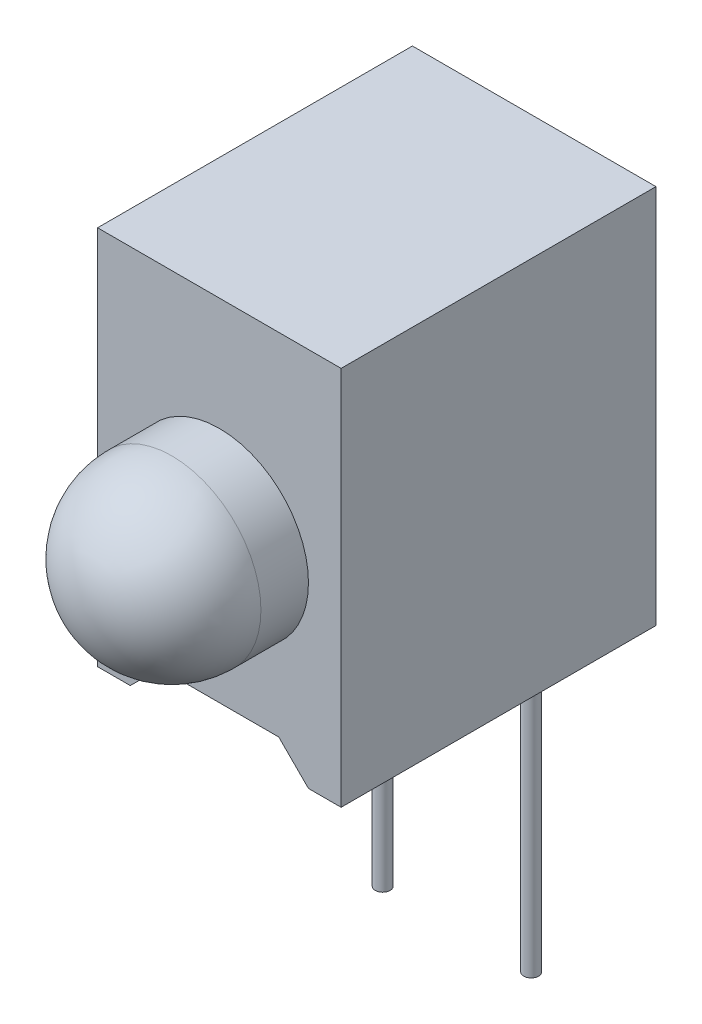
from build123d import *

# Parameters (mm, degrees)
EXTRUDE1_DEPTH = 5.3
SKETCH2_R      = 1.5
EXTRUDE2_DEPTH = 2.3
FILLET1_R      = 1.5
SKETCH3_R      = 0.125
EXTRUDE3_DEPTH = 5.3


with BuildPart() as part:
    # Sketch1 → Extrude1 (new body)
    with BuildSketch(Plane.XY):
        Polygon((-1, 0.5), (1, 0.5), (1.5, 0), (2.05, 0), (2.05, 6.4), (-2.05, 6.4), (-2.05, 0), (-1.5, 0), align=None)
    extrude(amount=-EXTRUDE1_DEPTH)

    # Sketch2 → Extrude2 (add)
    with BuildSketch(Plane.XY):
        with Locations(Location((0, 3, 0), (0, 0, 180))):
            Circle(SKETCH2_R)
    extrude(amount=EXTRUDE2_DEPTH)

    # Fillet1
    fillet1_edges = [part.edges().sort_by_distance(p)[0] for p in [
        (1.5, 3, 2.3),
    ]]
    fillet(fillet1_edges, radius=FILLET1_R)

    # Sketch3 → Extrude3 (add)
    with BuildSketch(Plane.XZ.offset(-0.5)):
        with Locations(Location((1.25, -4, 0), (0, 0, 180))):
            Circle(SKETCH3_R)
        with Locations(Location((-1.25, -4, 0), (0, 0, 90))):
            Circle(SKETCH3_R)
    extrude(amount=EXTRUDE3_DEPTH)


solid = part.part
